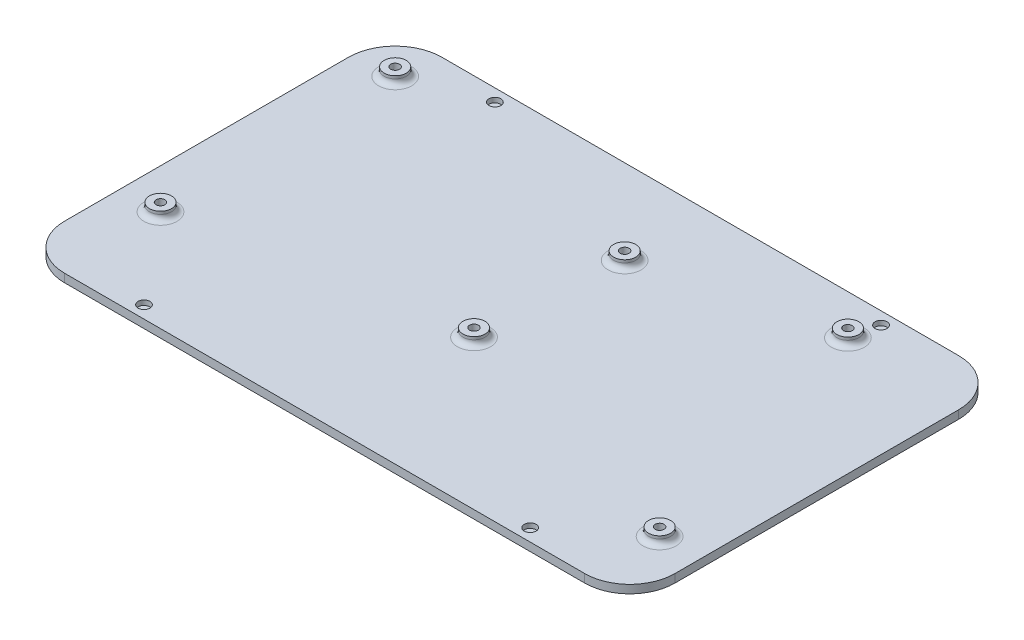
from build123d import *

# Parameters (mm, degrees)
SKETCH1_W                = 201.28
SKETCH1_H                = 116.21
BOSS_EXTRUDE1_DEPTH      = 3
FILLET1_R                = 6.98
FILLET2_R                = 6.35
BOSS_EXTRUDE3_DEPTH      = 3
SKETCH3_R                = 2.15
CUT_EXTRUDE1_DEPTH       = 1.75
M3_CLEARANCE_HOLE2_D     = 3.2
M3_CLEARANCE_HOLE2_DEPTH = 2
SKETCH8_R                = 4
BOSS_EXTRUDE4_DEPTH      = 3
FILLET3_R                = 2
M3_CLEARANCE_HOLE3_D     = 3.2
M3_CLEARANCE_HOLE3_DEPTH = 3


with BuildPart() as part:
    # Sketch1 → Boss-Extrude1 (new body)
    with BuildSketch(Plane(origin=(0, 0, 0), x_dir=(1, 0, 0), z_dir=(0, 1, 0))):
        with Locations((-100.64, 58.105)):
            Rectangle(SKETCH1_W, SKETCH1_H)
    extrude(amount=-BOSS_EXTRUDE1_DEPTH)

    # Fillet1
    fillet1_edges = [part.edges().sort_by_distance(p)[0] for p in [
        (-201.28, -1.5, -116.21),
        (0, -1.5, -116.21),
    ]]
    fillet(fillet1_edges, radius=FILLET1_R)

    # Fillet2
    fillet2_edges = [part.edges().sort_by_distance(p)[0] for p in [
        (0, -1.5, 0),
        (-201.28, -1.5, 0),
    ]]
    fillet(fillet2_edges, radius=FILLET2_R)

    # Sketch2 → Boss-Extrude3 (add)
    with BuildSketch(Plane(origin=(0, -3, 0), x_dir=(-1, 0, 0), z_dir=(0, -1, 0))):
        with BuildLine():
            Line((6.35, -10), (194.93, -10))
            ThreePointArc((194.93, -10), (206.491195872, -5.211195872), (211.28, 6.35))
            Line((211.28, 6.35), (211.28, 109.23))
            ThreePointArc((211.28, 109.23), (206.306673145, 121.236673145), (194.3, 126.21))
            Line((194.3, 126.21), (6.98, 126.21))
            ThreePointArc((6.98, 126.21), (-5.026673145, 121.236673145), (-10, 109.23))
            Line((-10, 109.23), (-10, 6.35))
            ThreePointArc((-10, 6.35), (-5.211195872, -5.211195872), (6.35, -10))
        make_face()
        with BuildLine():
            Line((6.35, 0), (194.93, 0))
            ThreePointArc((194.93, 0), (199.420128061, 1.859871939), (201.28, 6.35))
            Line((201.28, 6.35), (201.28, 109.23))
            ThreePointArc((201.28, 109.23), (199.235605333, 114.165605333), (194.3, 116.21))
            Line((194.3, 116.21), (6.98, 116.21))
            ThreePointArc((6.98, 116.21), (2.044394667, 114.165605333), (0, 109.23))
            Line((0, 109.23), (0, 6.35))
            ThreePointArc((0, 6.35), (1.859871939, 1.859871939), (6.35, 0))
        make_face(mode=Mode.SUBTRACT)
    extrude(amount=-BOSS_EXTRUDE3_DEPTH)

    # Sketch3 → Cut-Extrude1 (cut)
    with BuildSketch(Plane(origin=(0, 0, 0), x_dir=(1, 0, 0), z_dir=(0, 1, 0))):
        with Locations(Location((-170.64, -5.5, 0), (0, 0, 90))):
            Circle(SKETCH3_R)
        with Locations(Location((-30.64, 121.71, 0), (0, 0, 90))):
            Circle(SKETCH3_R)
        with Locations(Location((-30.64, -5.5, 0), (0, 0, 270))):
            Circle(SKETCH3_R)
        with Locations(Location((-170.64, 121.71, 0), (0, 0, 270))):
            Circle(SKETCH3_R)
    extrude(amount=-CUT_EXTRUDE1_DEPTH, mode=Mode.SUBTRACT)

    # M3 Clearance Hole2
    with Locations(Plane(origin=(0, 0, 0), x_dir=(1, 0, 0), z_dir=(0, 1, 0))):
        with Locations((-196.83, 111.76), (-32.71, 111.76), (-97.45, 95.57), (-100.63, 44.13), (-4.45, 15.24), (-196.83, 26.67)):
            Hole(M3_CLEARANCE_HOLE2_D / 2, depth=M3_CLEARANCE_HOLE2_DEPTH)

    # Sketch8 → Boss-Extrude4 (add)
    with BuildSketch(Plane(origin=(0, 0, 0), x_dir=(1, 0, 0), z_dir=(0, 1, 0))):
        with Locations(Location((-196.83, 111.76, 0), (0, 0, 270))):
            Circle(SKETCH8_R)
        with Locations(Location((-196.83, 26.67, 0), (0, 0, 270))):
            Circle(SKETCH8_R)
        with Locations(Location((-100.63, 44.13, 0), (0, 0, 270))):
            Circle(SKETCH8_R)
        with Locations(Location((-4.45, 15.24, 0), (0, 0, 270))):
            Circle(SKETCH8_R)
        with Locations(Location((-97.45, 95.57, 0), (0, 0, 270))):
            Circle(SKETCH8_R)
        with Locations(Location((-32.71, 111.76, 0), (0, 0, 270))):
            Circle(SKETCH8_R)
    extrude(amount=BOSS_EXTRUDE4_DEPTH)

    # Fillet3
    fillet3_edges = [part.edges().sort_by_distance(p)[0] for p in [
        (-196.83, 0, -115.76),
        (-196.83, 0, -30.67),
        (-100.63, 0, -48.13),
        (-4.45, 0, -19.24),
        (-97.45, 0, -99.57),
        (-32.71, 0, -115.76),
    ]]
    fillet(fillet3_edges, radius=FILLET3_R)

    # M3 Clearance Hole3
    with Locations(Plane(origin=(0, 3, 0), x_dir=(1, 0, 0), z_dir=(0, 1, 0))):
        with Locations((-4.45, 15.24), (-32.71, 111.76), (-97.45, 95.57), (-100.63, 44.13), (-196.83, 111.76), (-196.83, 26.67)):
            Hole(M3_CLEARANCE_HOLE3_D / 2, depth=M3_CLEARANCE_HOLE3_DEPTH)


solid = part.part
